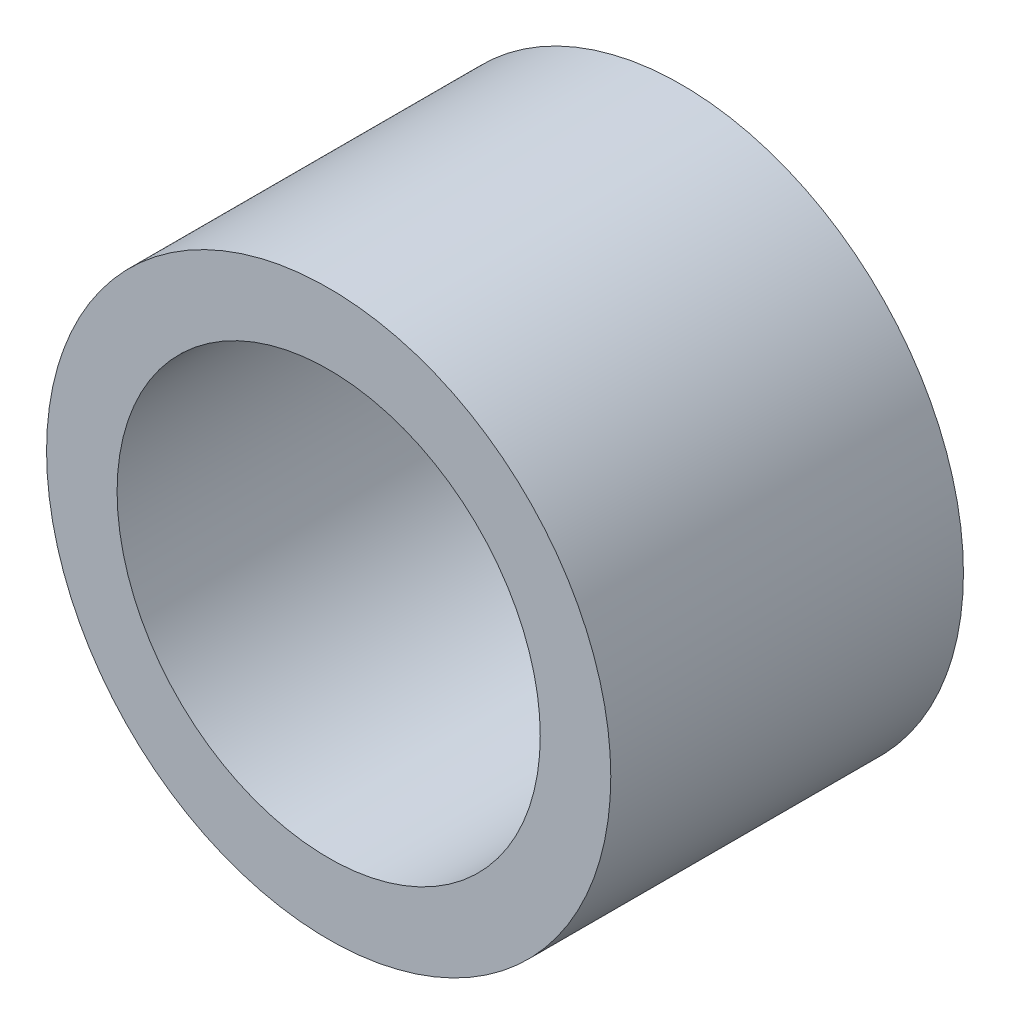
from build123d import *

# Parameters (mm, degrees)
ESQUISSE2_R        = 6
ESQUISSE2_R_2      = 4.5
BOSS_EXTRU_1_DEPTH = 7.5


with BuildPart() as part:
    # Esquisse2 → Boss.-Extru.1 (new body)
    with BuildSketch(Plane.XY):
        Circle(ESQUISSE2_R)
        Circle(ESQUISSE2_R_2, mode=Mode.SUBTRACT)
    extrude(amount=BOSS_EXTRU_1_DEPTH)


solid = part.part
